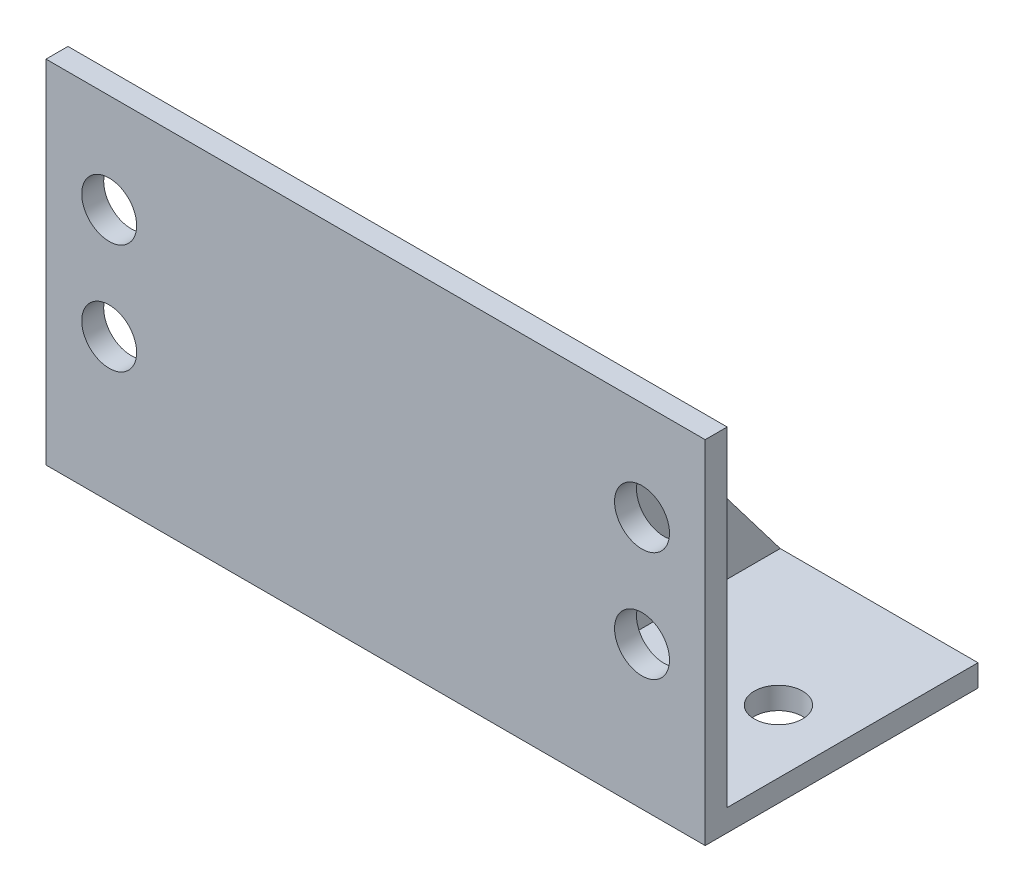
from build123d import *

# Parameters (mm, degrees)
SKETCH_1_W          = 60
SKETCH_1_H          = 24.832992812
SKETCH_1_R          = 2.2
EXTRUDE_2_DEPTH     = 2
SKETCH_6_W          = 2
SKETCH_6_H          = 22.832992812
SKETCH_6_W_2        = 60
SKETCH_6_H_2        = 2
EXTRUDE_3_DEPTH     = 30
CUT_EXTRUDE_1_DEPTH = 55.241767882
SKETCH_9_R          = 2.5
CUT_EXTRUDE_2_DEPTH = 51.405133984


with BuildPart() as part:
    # 草圖1 → 填料-伸長2 (new body)
    with BuildSketch(Plane(origin=(0, 0, 0), x_dir=(1, 0, 0), z_dir=(0, 1, 0))):
        Rectangle(SKETCH_1_W, SKETCH_1_H)
        with Locations(Location((-24.25, 0, 0), (0, 0, 270))):
            Circle(SKETCH_1_R, mode=Mode.SUBTRACT)
        with Locations(Location((0, 0, 0), (0, 0, 270))):
            Circle(SKETCH_1_R, mode=Mode.SUBTRACT)
        with Locations(Location((24.25, 0, 0), (0, 0, 270))):
            Circle(SKETCH_1_R, mode=Mode.SUBTRACT)
    extrude(amount=EXTRUDE_2_DEPTH)

    # 草圖6 → 填料-伸長3 (add)
    with BuildSketch(Plane(origin=(0, 2, 0), x_dir=(1, 0, 0), z_dir=(0, 1, 0))):
        with Locations((-11, 1)):
            Rectangle(SKETCH_6_W, SKETCH_6_H)
        with Locations((0, -11.416496406)):
            Rectangle(SKETCH_6_W_2, SKETCH_6_H_2)
        with Locations((11, 1)):
            Rectangle(SKETCH_6_W, SKETCH_6_H)
    extrude(amount=EXTRUDE_3_DEPTH)

    # 草圖8 → 除料-伸長1 (cut, through all)
    with BuildSketch(Plane.ZY.offset(12)):
        Polygon((10.416496406, 32), (-12.416496406, 2), (-12.416496406, 32), align=None)
    extrude(amount=-CUT_EXTRUDE_1_DEPTH, mode=Mode.SUBTRACT)

    # 草圖9 → 除料-伸長2 (cut, through all)
    with BuildSketch(Plane.XY.offset(12.416496406)):
        with Locations((-24.25, 13)):
            Circle(SKETCH_9_R)
        with Locations((24.25, 13)):
            Circle(SKETCH_9_R)
        with Locations((24.25, 23)):
            Circle(SKETCH_9_R)
        with Locations((-24.25, 23)):
            Circle(SKETCH_9_R)
    extrude(amount=-CUT_EXTRUDE_2_DEPTH, mode=Mode.SUBTRACT)


solid = part.part
